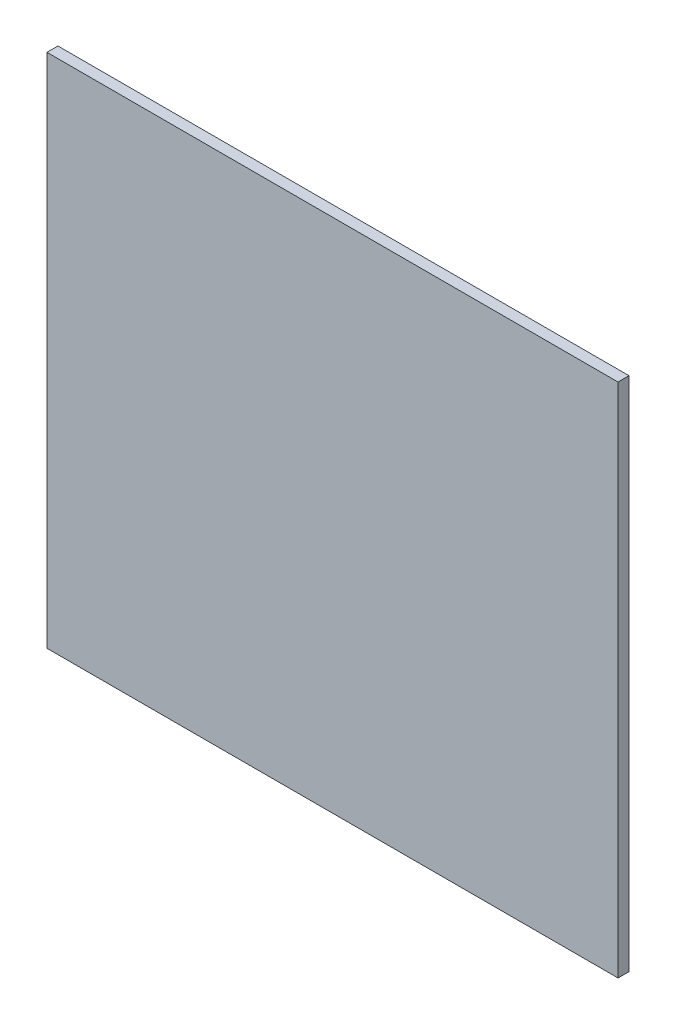
from build123d import *

# Parameters (mm, degrees)
ESQUISSE1_W        = 260
ESQUISSE1_H        = 235
BOSS_EXTRU_1_DEPTH = 5


with BuildPart() as part:
    # Esquisse1 → Boss.-Extru.1 (new body)
    with BuildSketch(Plane.XY):
        with Locations((-130, -117.5)):
            Rectangle(ESQUISSE1_W, ESQUISSE1_H)
    extrude(amount=BOSS_EXTRU_1_DEPTH)


solid = part.part
